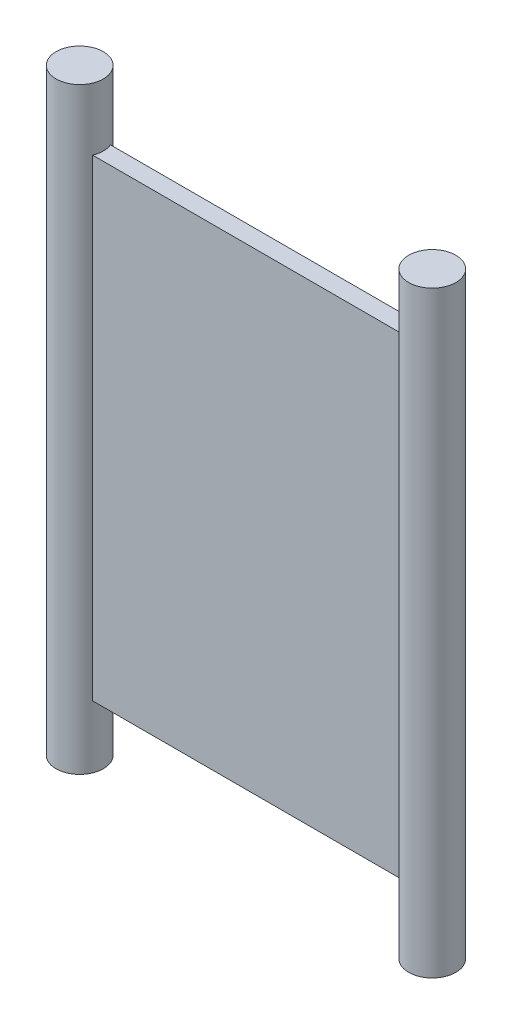
from build123d import *

# Parameters (mm, degrees)
SKETCH1_W           = 19.77
SKETCH1_H           = 1
BOSS_EXTRUDE1_DEPTH = 26.5
SKETCH2_R           = 1.325
BOSS_EXTRUDE2_DEPTH = 16.75


with BuildPart() as part:
    # Sketch1 → Boss-Extrude1 (new body)
    with BuildSketch(Plane(origin=(0, 0, 0), x_dir=(1, 0, 0), z_dir=(0, 1, 0))):
        Rectangle(SKETCH1_W, SKETCH1_H)
    extrude(amount=BOSS_EXTRUDE1_DEPTH)

    # Sketch2 → Boss-Extrude2 (add, symmetric)
    with BuildSketch(Plane(origin=(0, 13.25, 0), x_dir=(1, 0, 0), z_dir=(0, 1, 0))):
        with Locations(Location((-9.885, 0, 0), (0, 0, 270))):
            Circle(SKETCH2_R)
        with Locations(Location((9.885, 0, 0), (0, 0, 270))):
            Circle(SKETCH2_R)
    extrude(amount=BOSS_EXTRUDE2_DEPTH, both=True)


solid = part.part
